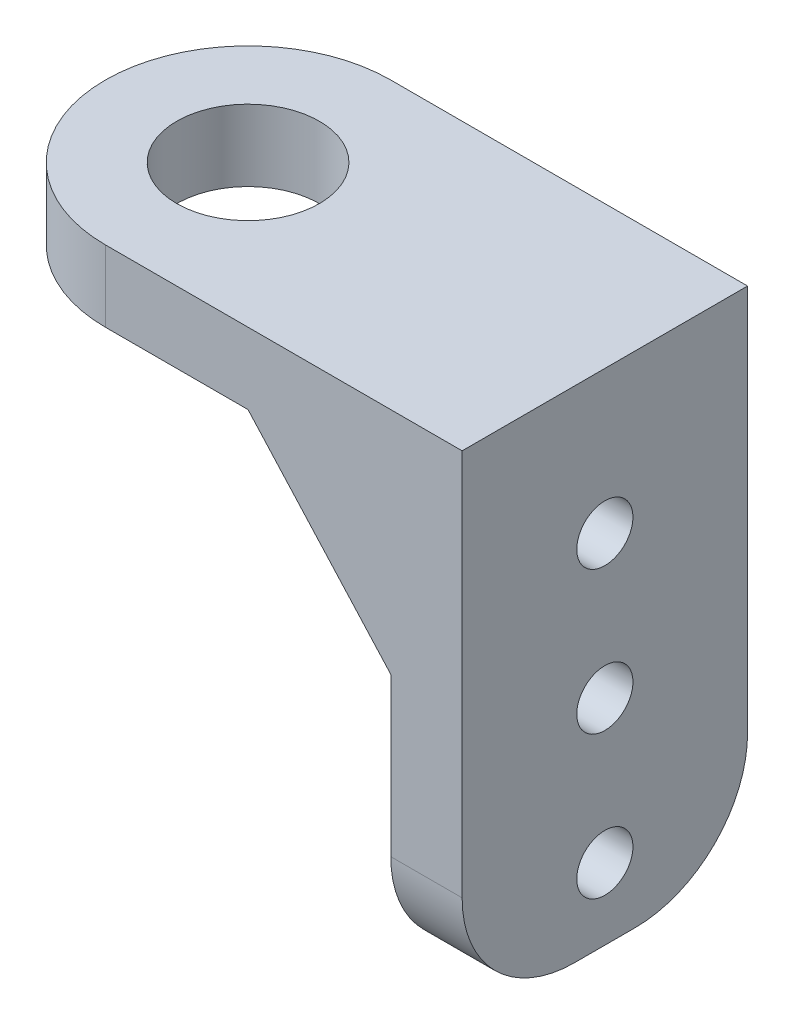
from build123d import *

# Parameters (mm, degrees)
SKETCH1_R           = 12.7
SKETCH1_R_2         = 6.35
BOSS_EXTRUDE1_DEPTH = 3.175
SKETCH2_W           = 6.35
SKETCH2_H           = 38.1
BOSS_EXTRUDE2_DEPTH = 25.4
SKETCH3_R           = 2.5
CUT_EXTRUDE1_DEPTH  = 58.589283942
FILLET1_R           = 10
RIB13_REACH         = 58.3
SKETCH4_WALL_W      = 133.538435182
SKETCH4_WALL_H      = 4


with BuildPart() as part:
    # Sketch1 → Boss-Extrude1 (new, symmetric)
    # profile 1 of 3: a face of its own
    with BuildSketch(Plane(origin=(0, 0, 0), x_dir=(1, 0, 0), z_dir=(0, 1, 0))):
        Circle(SKETCH1_R)
        with Locations(Location((0, 0, 0), (0, 0, 270))):
            Circle(SKETCH1_R_2, mode=Mode.SUBTRACT)
    # profile 2 of 3: a face of its own
    with BuildSketch(Plane(origin=(0, 0, 0), x_dir=(1, 0, 0), z_dir=(0, 1, 0))):
        with BuildLine():
            Line((31.75, 12.7), (12.7, 12.7))
            Line((12.7, 12.7), (12.7, 0))
            ThreePointArc((12.7, 0), (8.980256121, -8.980256121), (0, -12.7))
            Line((0, -12.7), (31.75, -12.7))
            Line((31.75, -12.7), (31.75, 12.7))
        make_face()
    # profile 3 of 3: a face of its own
    with BuildSketch(Plane(origin=(0, 0, 0), x_dir=(1, 0, 0), z_dir=(0, 1, 0))):
        with BuildLine():
            Line((12.7, 12.7), (0, 12.7))
            ThreePointArc((0, 12.7), (8.980256121, 8.980256121), (12.7, 0))
            Line((12.7, 0), (12.7, 12.7))
        make_face()
    extrude(amount=BOSS_EXTRUDE1_DEPTH, both=True)

    # Sketch2 → Boss-Extrude2 (add)
    with BuildSketch(Plane.XY.offset(12.7)):
        with Locations((28.575, -22.225)):
            Rectangle(SKETCH2_W, SKETCH2_H)
    extrude(amount=-BOSS_EXTRUDE2_DEPTH)

    # Sketch3 → Cut-Extrude1 (cut, through all)
    with BuildSketch(Plane.ZY.offset(-25.4)):
        with Locations(Location((0, -34.925, 0), (0, 0, 270))):
            Circle(SKETCH3_R)
        with Locations(Location((0, -9.525, 0), (0, 0, 270))):
            Circle(SKETCH3_R)
        with Locations(Location((0, -22.225, 0), (0, 0, 270))):
            Circle(SKETCH3_R)
    extrude(amount=-CUT_EXTRUDE1_DEPTH, mode=Mode.SUBTRACT)

    # Fillet1
    fillet1_edges = [part.edges().sort_by_distance(p)[0] for p in [
        (28.575, -41.275, 12.7),
        (28.575, -41.275, -12.7),
    ]]
    fillet(fillet1_edges, radius=FILLET1_R)

    # Sketch4 wall → Rib13 (add, up to next)
    with BuildSketch(Plane(origin=(19.05, -10.2, 8.7), x_dir=(0.670567611254, -0.741848420324, 0), z_dir=(0.741848420324, 0.670567611254, 0)), mode=Mode.PRIVATE) as rib13_sk1:
        with Locations((0, -2)):
            Rectangle(SKETCH4_WALL_W, SKETCH4_WALL_H)
    rib13_tool1 = extrude(rib13_sk1.sketch, amount=RIB13_REACH, mode=Mode.PRIVATE) - part.part
    rib13 = rib13_tool1.solids().sort_by_distance((19.05, -10.2, 8.7))[0]
    add(rib13)

    # Mirror1: Rib13 across plane
    add(rib13.mirror(Plane.XY))


solid = part.part
